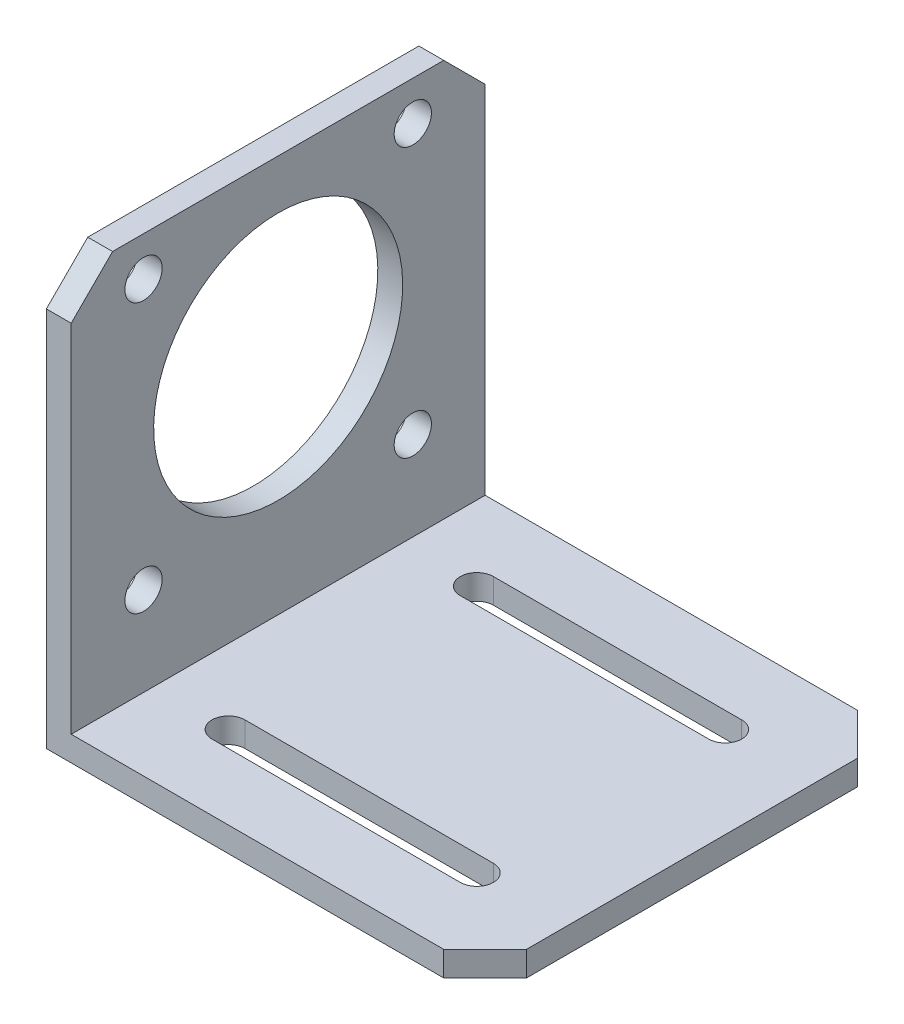
from build123d import *

# Parameters (mm, degrees)
EXTRUDE_1_DEPTH          = 50
CHAMFER_1_SIZE           = 5
CUT_EXTRUDE_1_DEPTH      = 88.183714076
CUT_EXTRUDE_1_DEPTH_BACK = 88.183714076
SKETCH_2_R               = 15.04
SKETCH_2_R_2             = 2.25
CUT_EXTRUDE_2_DEPTH      = 88.252507127
CUT_EXTRUDE_2_DEPTH_BACK = 88.252507127


with BuildPart() as part:
    # 草图1 → 凸台-拉伸1 (new body)
    with BuildSketch(Plane.XY):
        Polygon((0, 0), (53, 0), (53, 3), (3, 3), (3, 51), (0, 51), align=None)
    extrude(amount=EXTRUDE_1_DEPTH)

    # 倒角1
    chamfer_1_edges = [part.edges().sort_by_distance(p)[0] for p in [
        (53, 1.5, 50),
        (1.5, 51, 50),
        (1.5, 51, 0),
        (53, 1.5, 0),
    ]]
    chamfer(chamfer_1_edges, length=CHAMFER_1_SIZE)

    # 草图2 → 切除-拉伸1 (cut, two sides: drawn at the far end of the back side and taken through both)
    with BuildSketch(Plane(origin=(3, 0, 0), x_dir=(0, 0, -1), z_dir=(1, 0, 0)).offset(-CUT_EXTRUDE_1_DEPTH_BACK)):
        with Locations(Location((-25, 30, 0), (0, 0, 90))):
            Circle(SKETCH_2_R)
        with Locations(Location((-8.735, 46.265, 0), (0, 0, 90))):
            Circle(SKETCH_2_R_2)
        with Locations(Location((-41.265, 46.265, 0), (0, 0, 90))):
            Circle(SKETCH_2_R_2)
        with Locations(Location((-8.735, 13.735, 0), (0, 0, 90))):
            Circle(SKETCH_2_R_2)
        with Locations(Location((-41.265, 13.735, 0), (0, 0, 90))):
            Circle(SKETCH_2_R_2)
    extrude(amount=CUT_EXTRUDE_1_DEPTH + CUT_EXTRUDE_1_DEPTH_BACK, mode=Mode.SUBTRACT)

    # 草图4 → 切除-拉伸2 (cut, two sides: drawn at the far end of the back side and taken through both)
    with BuildSketch(Plane(origin=(0, 3, 0), x_dir=(1, 0, 0), z_dir=(0, 1, 0)).offset(-CUT_EXTRUDE_2_DEPTH_BACK)):
        with BuildLine():
            Line((12, -12), (42, -12))
            ThreePointArc((42, -12), (44, -10), (42, -8))
            Line((42, -8), (12, -8))
            ThreePointArc((12, -8), (10, -10), (12, -12))
        make_face()
        with BuildLine():
            Line((12, -38), (42, -38))
            ThreePointArc((42, -38), (44, -40), (42, -42))
            Line((42, -42), (12, -42))
            ThreePointArc((12, -42), (10, -40), (12, -38))
        make_face()
    extrude(amount=CUT_EXTRUDE_2_DEPTH + CUT_EXTRUDE_2_DEPTH_BACK, mode=Mode.SUBTRACT)


solid = part.part
